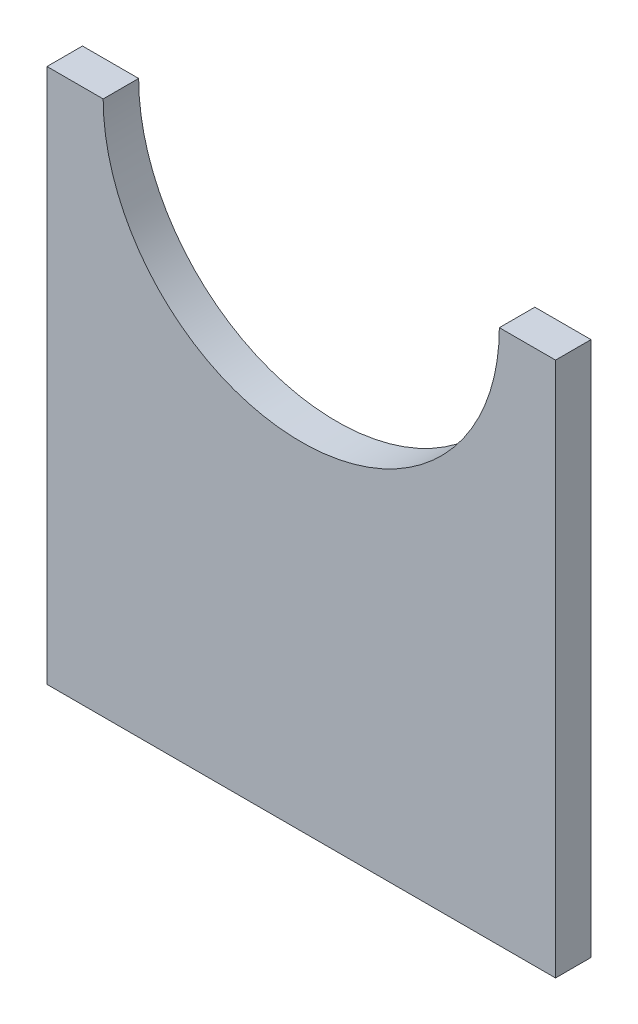
from build123d import *

# Parameters (mm, degrees)
BOSS_EXTRUDE1_DEPTH = 3


with BuildPart() as part:
    # Sketch1 → Boss-Extrude1 (new body)
    with BuildSketch(Plane.XY):
        with BuildLine():
            Line((-16.75, 0), (-21.5, 0))
            Line((-21.5, 0), (-21.5, -45.25))
            Line((-21.5, -45.25), (-5, -45.25))
            Line((-5, -45.25), (5, -45.25))
            Line((5, -45.25), (21.5, -45.25))
            Line((21.5, -45.25), (21.5, 0))
            Line((21.5, 0), (16.75, 0))
            ThreePointArc((16.75, 0), (0, -16.75), (-16.75, 0))
        make_face()
    extrude(amount=BOSS_EXTRUDE1_DEPTH)


solid = part.part
